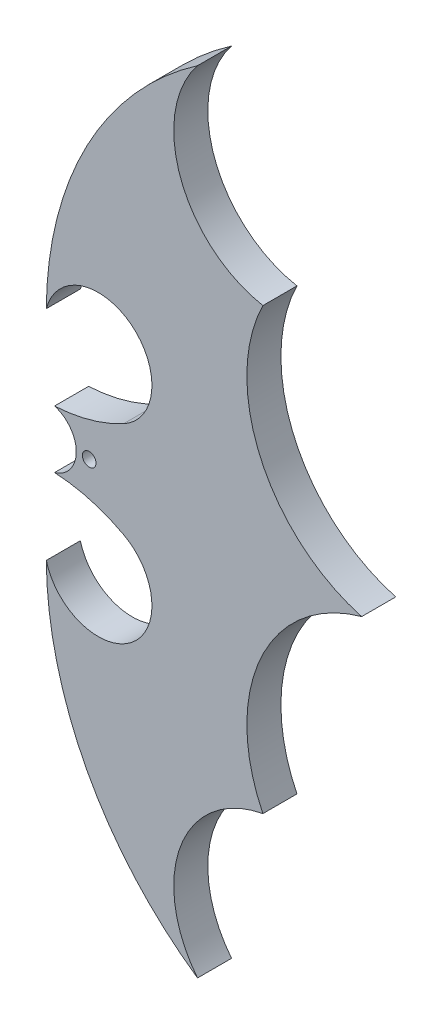
from build123d import *

# Parameters (mm, degrees)
BOSS_EXTRUDE1_DEPTH = 5
SKETCH2_R           = 1
CUT_EXTRUDE2_DEPTH  = 5


with BuildPart() as part:
    # Sketch1 → Boss-Extrude1 (new body)
    with BuildSketch(Plane(origin=(0, 0, 0), x_dir=(0, 1, 0), z_dir=(0, 0, 1))):
        with BuildLine():
            ThreePointArc((0, 0), (12.744177426, 14.83676339), (32.3, 14.5))
            ThreePointArc((32.3, 14.5), (42.433307292, 26.572812771), (58, 24.1))
            ThreePointArc((58, 24.1), (39.71268336, 40.332103653), (16, 46.3))
            ThreePointArc((16, 46.3), (20.191750993, 33.797330101), (7.055281526, 34.946547632))
            ThreePointArc((7.055281526, 34.946547632), (5.079702, 39.861691185), (4.230496454, 45.090496071))
            ThreePointArc((4.230496454, 45.090496071), (0, 41.9), (-4.230496454, 45.090496071))
            ThreePointArc((-4.230496454, 45.090496071), (-5.079702, 39.861691185), (-7.055281526, 34.946547632))
            ThreePointArc((-7.055281526, 34.946547632), (-20.191750993, 33.797330101), (-16, 46.3))
            ThreePointArc((-16, 46.3), (-39.71268336, 40.332103653), (-58, 24.1))
            ThreePointArc((-58, 24.1), (-42.433307292, 26.572812771), (-32.3, 14.5))
            ThreePointArc((-32.3, 14.5), (-12.744177426, 14.83676339), (0, 0))
        make_face()
    extrude(amount=BOSS_EXTRUDE1_DEPTH)

    # Sketch2 → Cut-Extrude2 (cut)
    with BuildSketch(Plane.XY.offset(5)):
        with Locations((-40, 0)):
            Circle(SKETCH2_R)
    extrude(amount=-CUT_EXTRUDE2_DEPTH, mode=Mode.SUBTRACT)


solid = part.part
